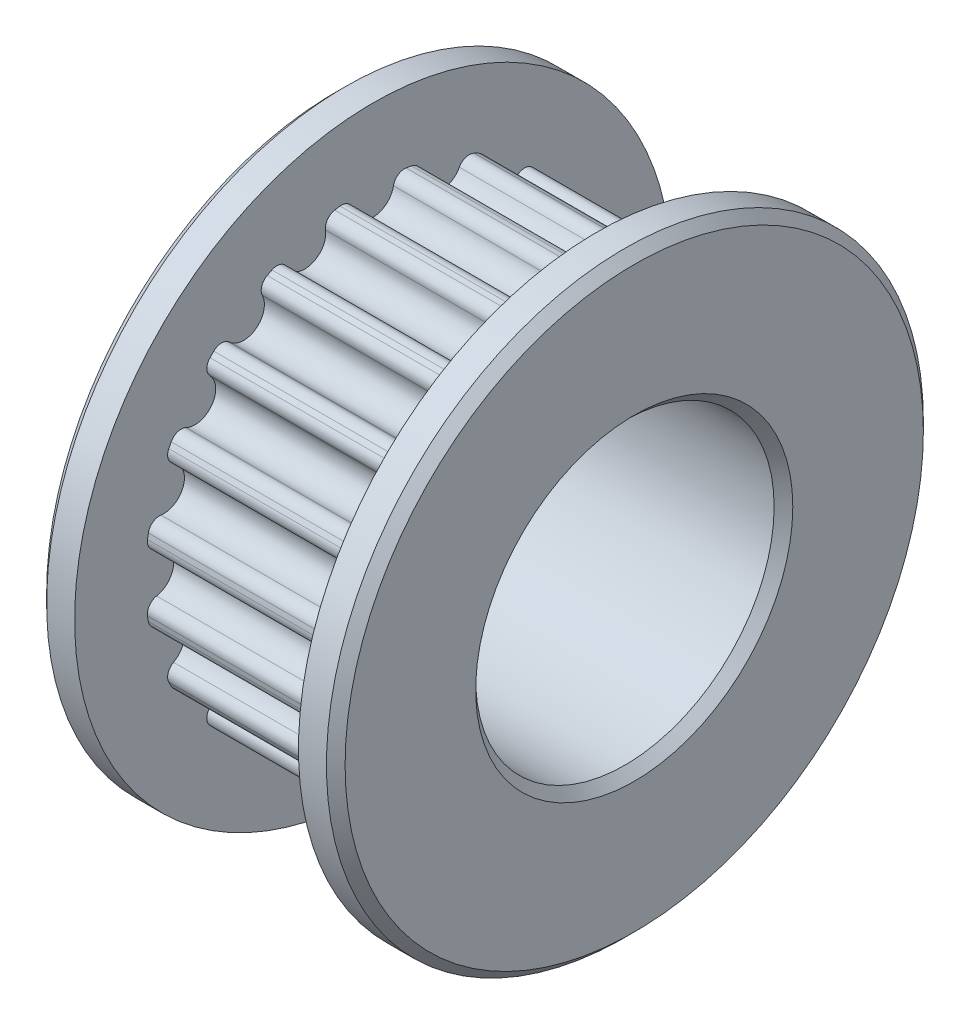
from build123d import *

# Parameters (mm, degrees)
BOSS_EXTRUDE1_DEPTH     = 6
FILLET1_R               = 0.3
SKETCH2_R               = 8
BOSS_EXTRUDE2_DEPTH     = 9
BOSS_EXTRUDE3_START     = 1
SKETCH3_R               = 8
BOSS_EXTRUDE3_DEPTH     = 1
CUT_EXTRUDE1_DEPTH      = 15.456832405
CUT_EXTRUDE1_DEPTH_BACK = 15.456832405
SKETCH4_R               = 4
CHAMFER1_SIZE           = 0.25
SKETCH5_R               = 1.75
CUT_EXTRUDE2_DEPTH      = 15.456832405
SKETCH6_R               = 1.75
CUT_EXTRUDE3_DEPTH      = 15.456832405
SKETCH11_R              = 9.101949813
CUT_EXTRUDE4_DEPTH      = 8
CHAMFER2_SIZE           = 0.25


with BuildPart() as part:
    # Sketch1 → Boss-Extrude1 (new body)
    with BuildSketch(Plane(origin=(0, 0, 0), x_dir=(0, 0, -1), z_dir=(1, 0, 0))):
        with BuildLine():
            ThreePointArc((0.5225186, -6.087616472), (0.955814581, -6.034775761), (1.384232226, -5.951134442))
            ThreePointArc((1.384232226, -5.951134442), (1.651861295, -5.083906312), (2.378121664, -5.628200187))
            ThreePointArc((2.378121664, -5.628200187), (2.773881953, -5.444049863), (3.155484757, -5.232113908))
            ThreePointArc((3.155484757, -5.232113908), (3.142026897, -4.324629014), (4.000937611, -4.617856454))
            ThreePointArc((4.000937611, -4.617856454), (4.320422433, -4.320422433), (4.617856454, -4.000937611))
            ThreePointArc((4.617856454, -4.000937611), (4.324629014, -3.142026897), (5.232113908, -3.155484757))
            ThreePointArc((5.232113908, -3.155484757), (5.444049863, -2.773881953), (5.628200187, -2.378121664))
            ThreePointArc((5.628200187, -2.378121664), (5.083906312, -1.651861295), (5.951134442, -1.384232226))
            ThreePointArc((5.951134442, -1.384232226), (6.034775761, -0.955814581), (6.087616472, -0.5225186))
            ThreePointArc((6.087616472, -0.5225186), (5.345535439, 0), (6.087616472, 0.5225186))
            ThreePointArc((6.087616472, 0.5225186), (6.034775761, 0.955814581), (5.951134442, 1.384232226))
            ThreePointArc((5.951134442, 1.384232226), (5.083906312, 1.651861295), (5.628200187, 2.378121664))
            ThreePointArc((5.628200187, 2.378121664), (5.444049863, 2.773881953), (5.232113908, 3.155484757))
            ThreePointArc((5.232113908, 3.155484757), (4.324629014, 3.142026897), (4.617856454, 4.000937611))
            ThreePointArc((4.617856454, 4.000937611), (4.320422433, 4.320422433), (4.000937611, 4.617856454))
            ThreePointArc((4.000937611, 4.617856454), (3.142026897, 4.324629014), (3.155484757, 5.232113908))
            ThreePointArc((3.155484757, 5.232113908), (2.773881953, 5.444049863), (2.378121664, 5.628200187))
            ThreePointArc((2.378121664, 5.628200187), (1.651861295, 5.083906312), (1.384232226, 5.951134442))
            ThreePointArc((1.384232226, 5.951134442), (0.955814581, 6.034775761), (0.5225186, 6.087616472))
            ThreePointArc((0.5225186, 6.087616472), (0, 5.345535439), (-0.5225186, 6.087616472))
            ThreePointArc((-0.5225186, 6.087616472), (-0.955814581, 6.034775761), (-1.384232226, 5.951134442))
            ThreePointArc((-1.384232226, 5.951134442), (-1.651861295, 5.083906312), (-2.378121664, 5.628200187))
            ThreePointArc((-2.378121664, 5.628200187), (-2.773881953, 5.444049863), (-3.155484757, 5.232113908))
            ThreePointArc((-3.155484757, 5.232113908), (-3.142026897, 4.324629014), (-4.000937611, 4.617856454))
            ThreePointArc((-4.000937611, 4.617856454), (-4.320422433, 4.320422433), (-4.617856454, 4.000937611))
            ThreePointArc((-4.617856454, 4.000937611), (-4.324629014, 3.142026897), (-5.232113908, 3.155484757))
            ThreePointArc((-5.232113908, 3.155484757), (-5.444049863, 2.773881953), (-5.628200187, 2.378121664))
            ThreePointArc((-5.628200187, 2.378121664), (-5.083906312, 1.651861295), (-5.951134442, 1.384232226))
            ThreePointArc((-5.951134442, 1.384232226), (-6.034775761, 0.955814581), (-6.087616472, 0.5225186))
            ThreePointArc((-6.087616472, 0.5225186), (-5.345535439, 0), (-6.087616472, -0.5225186))
            ThreePointArc((-6.087616472, -0.5225186), (-6.034775761, -0.955814581), (-5.951134442, -1.384232226))
            ThreePointArc((-5.951134442, -1.384232226), (-5.083906312, -1.651861295), (-5.628200187, -2.378121664))
            ThreePointArc((-5.628200187, -2.378121664), (-5.444049863, -2.773881953), (-5.232113908, -3.155484757))
            ThreePointArc((-5.232113908, -3.155484757), (-4.324629014, -3.142026897), (-4.617856454, -4.000937611))
            ThreePointArc((-4.617856454, -4.000937611), (-4.320422433, -4.320422433), (-4.000937611, -4.617856454))
            ThreePointArc((-4.000937611, -4.617856454), (-3.142026897, -4.324629014), (-3.155484757, -5.232113908))
            ThreePointArc((-3.155484757, -5.232113908), (-2.773881953, -5.444049863), (-2.378121664, -5.628200187))
            ThreePointArc((-2.378121664, -5.628200187), (-1.651861295, -5.083906312), (-1.384232226, -5.951134442))
            ThreePointArc((-1.384232226, -5.951134442), (-0.955814581, -6.034775761), (-0.5225186, -6.087616472))
            ThreePointArc((-0.5225186, -6.087616472), (0, -5.345535439), (0.5225186, -6.087616472))
        make_face()
    extrude(amount=BOSS_EXTRUDE1_DEPTH)

    # Fillet1
    fillet1_edges = [part.edges().sort_by_distance(p)[0] for p in [
        (3, -6.087616472, 0.5225186),
        (3, -5.951134442, 1.384232226),
        (3, -5.628200187, 2.378121664),
        (3, -5.232113908, 3.155484757),
        (3, -4.617856454, 4.000937611),
        (3, -4.000937611, 4.617856454),
        (3, -3.155484757, 5.232113908),
        (3, -2.378121664, 5.628200187),
        (3, -1.384232226, 5.951134442),
        (3, -0.5225186, 6.087616472),
        (3, 0.5225186, 6.087616472),
        (3, 1.384232226, 5.951134442),
        (3, 2.378121664, 5.628200187),
        (3, 3.155484757, 5.232113908),
        (3, 4.000937611, 4.617856454),
        (3, 4.617856454, 4.000937611),
        (3, 5.232113908, 3.155484757),
        (3, 5.628200187, 2.378121664),
        (3, 5.951134442, 1.384232226),
        (3, 6.087616472, 0.5225186),
        (3, 6.087616472, -0.5225186),
        (3, 5.951134442, -1.384232226),
        (3, 5.628200187, -2.378121664),
        (3, 5.232113908, -3.155484757),
        (3, 4.617856454, -4.000937611),
        (3, 4.000937611, -4.617856454),
        (3, 3.155484757, -5.232113908),
        (3, 2.378121664, -5.628200187),
        (3, 1.384232226, -5.951134442),
        (3, 0.5225186, -6.087616472),
        (3, -0.5225186, -6.087616472),
        (3, -1.384232226, -5.951134442),
        (3, -2.378121664, -5.628200187),
        (3, -3.155484757, -5.232113908),
        (3, -4.000937611, -4.617856454),
        (3, -4.617856454, -4.000937611),
        (3, -5.232113908, -3.155484757),
        (3, -5.628200187, -2.378121664),
        (3, -5.951134442, -1.384232226),
        (3, -6.087616472, -0.5225186),
    ]]
    fillet(fillet1_edges, radius=FILLET1_R)

    # Sketch2 → Boss-Extrude2 (add)
    with BuildSketch(Plane(origin=(0, 0, 0), x_dir=(0, 0, -1), z_dir=(1, 0, 0))):
        Circle(SKETCH2_R)
    extrude(amount=-BOSS_EXTRUDE2_DEPTH)

    # Sketch3 → Boss-Extrude3 (add)
    with BuildSketch(Plane(origin=(6, 0, 0), x_dir=(0, 0, -1), z_dir=(1, 0, 0)).offset(BOSS_EXTRUDE3_START)):
        Circle(SKETCH3_R)
    extrude(amount=-BOSS_EXTRUDE3_DEPTH)

    # Sketch4 → Cut-Extrude1 (cut, two sides: drawn at the far end of the back side and taken through both)
    with BuildSketch(Plane(origin=(0, 0, 0), x_dir=(0, 0, -1), z_dir=(1, 0, 0)).offset(-CUT_EXTRUDE1_DEPTH_BACK)):
        Circle(SKETCH4_R)
    extrude(amount=CUT_EXTRUDE1_DEPTH + CUT_EXTRUDE1_DEPTH_BACK, mode=Mode.SUBTRACT)

    # Chamfer1
    chamfer1_edges = [part.edges().sort_by_distance(p)[0] for p in [
        (-9, 0, 8),
        (7, 0, 8),
        (-9, 0, 4),
        (7, 0, 4),
    ]]
    chamfer(chamfer1_edges, length=CHAMFER1_SIZE)

    # Sketch5 → Cut-Extrude2 (cut, through all)
    with BuildSketch(Plane.XY):
        with Locations((-5, 0)):
            Circle(SKETCH5_R)
    extrude(amount=-CUT_EXTRUDE2_DEPTH, mode=Mode.SUBTRACT)

    # Sketch6 → Cut-Extrude3 (cut, through all)
    with BuildSketch(Plane(origin=(0, 0, 0), x_dir=(1, 0, 0), z_dir=(0, 1, 0))):
        with Locations(Location((-5, 0, 0), (0, 0, 270))):
            Circle(SKETCH6_R)
    extrude(amount=-CUT_EXTRUDE3_DEPTH, mode=Mode.SUBTRACT)

    # Sketch11 → Cut-Extrude4 (cut)
    with BuildSketch(Plane.ZY.offset(9)):
        Circle(SKETCH11_R)
    extrude(amount=-CUT_EXTRUDE4_DEPTH, mode=Mode.SUBTRACT)

    # Chamfer2
    chamfer2_edges = [part.edges().sort_by_distance(p)[0] for p in [
        (-1, 0, 8),
    ]]
    chamfer(chamfer2_edges, length=CHAMFER2_SIZE)


solid = part.part
